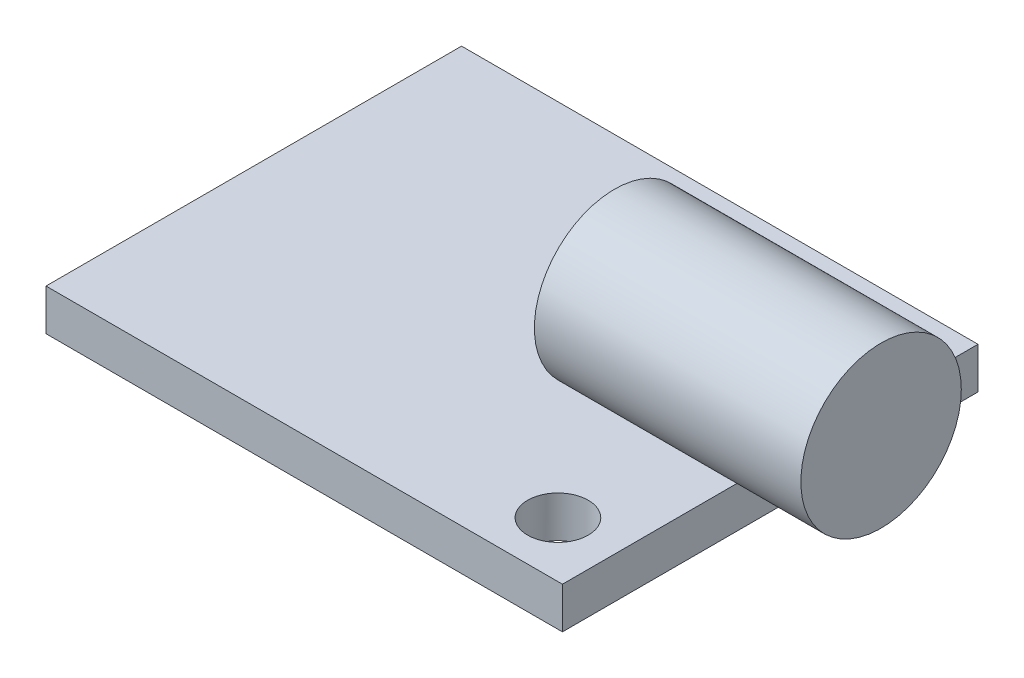
from build123d import *

# Parameters (mm, degrees)
SKETCH1_W                = 19.05
SKETCH1_H                = 15.3289
BOSS_EXTRUDE1_DEPTH      = 1.524
BOSS_EXTRUDE2_DEPTH      = 4.0894
BOSS_EXTRUDE2_DEPTH_BACK = 5.7404
SKETCH3_R                = 2.9591
SKETCH6_R                = 1.1176
CUT_EXTRUDE1_DEPTH       = 4.0894


with BuildPart() as part:
    # Sketch1 → Boss-Extrude1 (new body)
    with BuildSketch(Plane(origin=(0, 0, 0), x_dir=(1, 0, 0), z_dir=(0, 1, 0))):
        with Locations((9.525, -7.66445)):
            Rectangle(SKETCH1_W, SKETCH1_H)
    extrude(amount=BOSS_EXTRUDE1_DEPTH)

    # Sketch6 → Cut-Extrude1 (cut)
    with BuildSketch(Plane(origin=(0, 1.524, 0), x_dir=(1, 0, 0), z_dir=(0, 1, 0))):
        with Locations(Location((16.842353548, -13.287240698, 0), (0, 0, 270))):
            Circle(SKETCH6_R)
        with Locations(Location((16.842353548, -2.784340698, 0), (0, 0, 270))):
            Circle(SKETCH6_R)
    extrude(amount=-CUT_EXTRUDE1_DEPTH, mode=Mode.SUBTRACT)


with BuildPart() as body_2:
    # Sketch3 → Boss-Extrude2 (new, two sides: drawn at the far end of the back side and taken through both)
    with BuildSketch(Plane(origin=(19.05, 0, 0), x_dir=(0, 0, -1), z_dir=(1, 0, 0)).offset(-BOSS_EXTRUDE2_DEPTH_BACK)):
        with Locations((-7.66445, 4.4831)):
            Circle(SKETCH3_R)
    extrude(amount=BOSS_EXTRUDE2_DEPTH + BOSS_EXTRUDE2_DEPTH_BACK)


solid = Compound([part.part, body_2.part])
